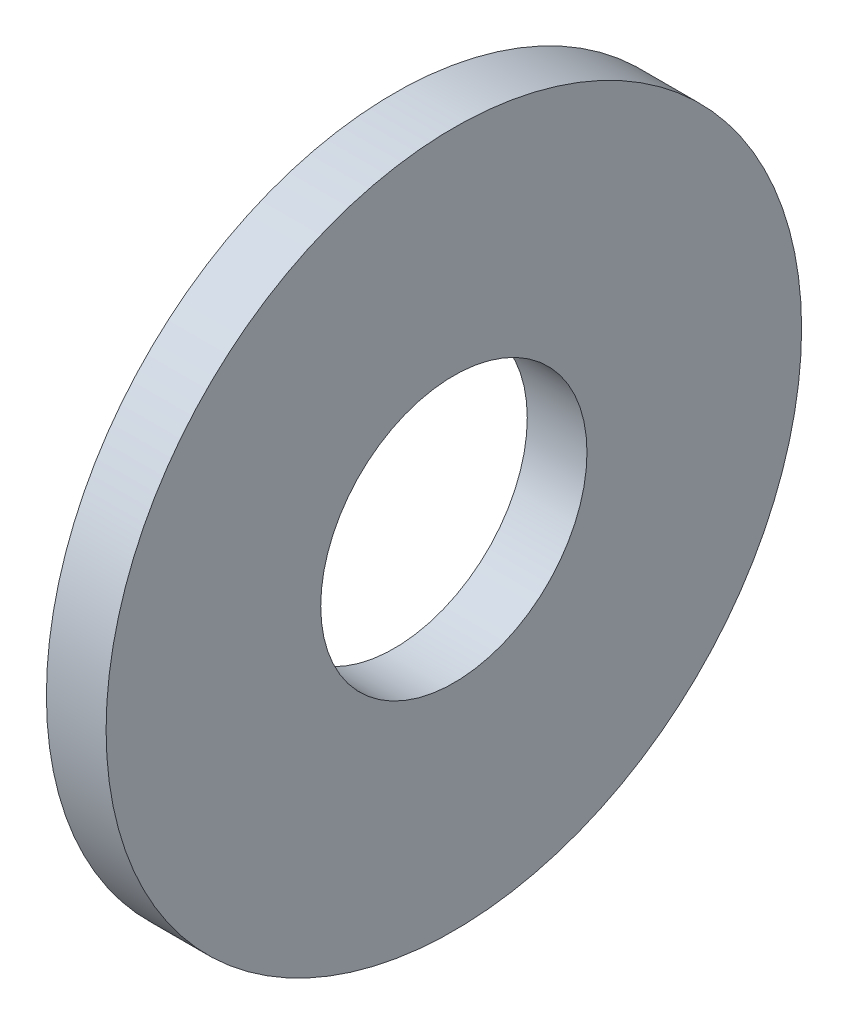
from build123d import *

# Parameters (mm, degrees)
SKETCH1_R   = 9.3218
SKETCH1_R_2 = 3.5687
BODY_DEPTH  = 1.6002


with BuildPart() as part:
    # Sketch1 → Body (new body)
    with BuildSketch(Plane.YZ):
        with Locations(Location((0, 0, 0), (0, 0, 270))):
            Circle(SKETCH1_R)
        with Locations(Location((0, 0, 0), (0, 0, 270))):
            Circle(SKETCH1_R_2, mode=Mode.SUBTRACT)
    extrude(amount=BODY_DEPTH)


solid = part.part
